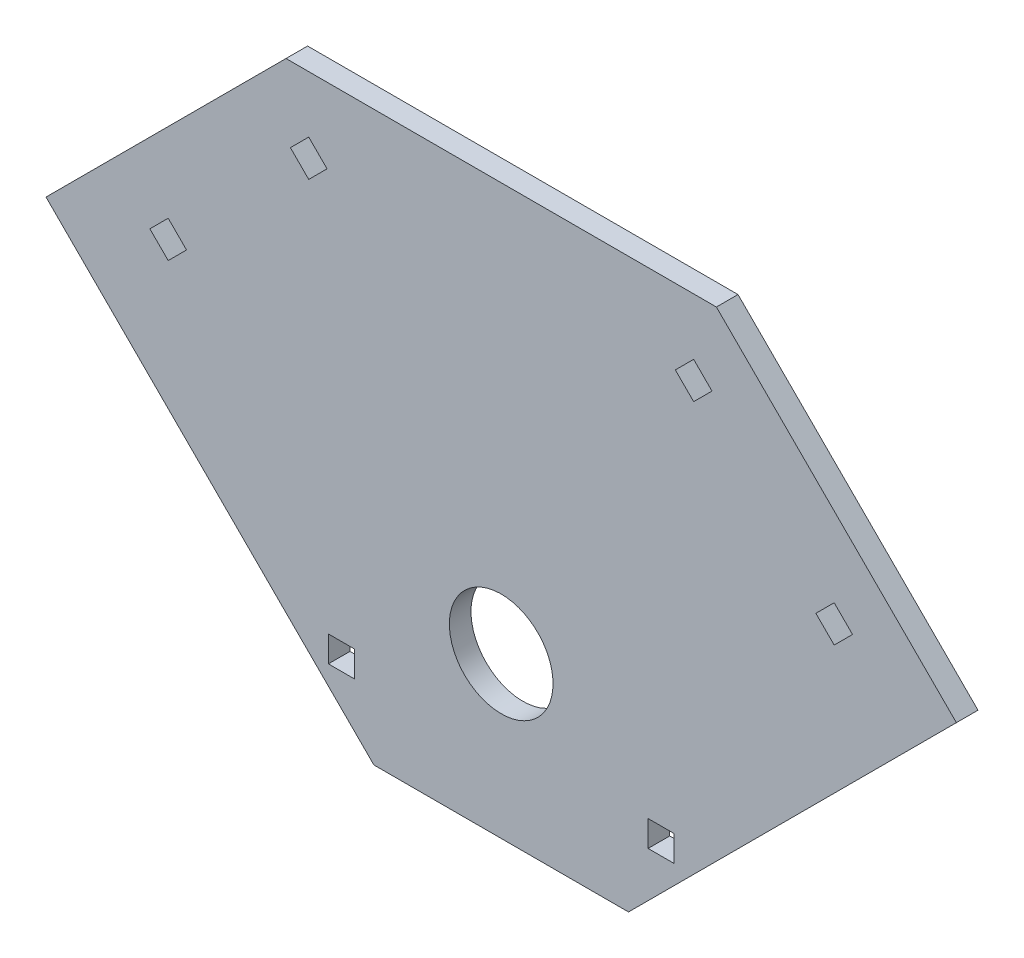
from build123d import *

# Parameters (mm, degrees)
SKETCH3_R           = 12
BOSS_EXTRUDE1_DEPTH = 5
BOSS_EXTRUDE2_DEPTH = 5
SKETCH6_W           = 6
SKETCH6_H           = 6
CUT_EXTRUDE1_DEPTH  = 5


with BuildPart() as part:
    # Sketch3 → Boss-Extrude1 (new body)
    with BuildSketch(Plane.XY):
        Polygon((-77.781745931, 49.497474683), (-49.497474683, 77.781745931), (-43.840620434, 83.43860018), (43.840620434, 83.43860018), (49.497474683, 77.781745931), (77.781745931, 49.497474683), (88.388347648, 38.890872965), (27.497474683, -22), (-27.497474683, -22), (-88.388347648, 38.890872965), align=None)
        Circle(SKETCH3_R, mode=Mode.SUBTRACT)
        Polygon((-81.317279836, 44.547727215), (-77.074639149, 48.790367902), (-72.831998462, 44.547727215), (-77.074639149, 40.305086528), align=None, mode=Mode.SUBTRACT)
        Polygon((-48.790367902, 77.074639149), (-44.547727215, 81.317279836), (-40.305086528, 77.074639149), (-44.547727215, 72.831998462), align=None, mode=Mode.SUBTRACT)
        Polygon((40.305086528, 77.074639149), (44.547727215, 72.831998462), (48.790367902, 77.074639149), (44.547727215, 81.317279836), align=None, mode=Mode.SUBTRACT)
        Polygon((72.831998462, 44.547727215), (77.074639149, 40.305086528), (81.317279836, 44.547727215), (77.074639149, 48.790367902), align=None, mode=Mode.SUBTRACT)
    extrude(amount=BOSS_EXTRUDE1_DEPTH)

    # Sketch5 → Boss-Extrude2 (add)
    with BuildSketch(Plane.XY.offset(5)):
        Polygon((-105.358910397, 38.890872965), (-49.811183182, 94.43860018), (49.811183182, 94.43860018), (105.358910397, 38.890872965), (29.468037432, -37), (-29.468037432, -37), align=None)
        Polygon((-43.840620434, 83.43860018), (-88.388347648, 38.890872965), (-27.497474683, -22), (27.497474683, -22), (88.388347648, 38.890872965), (43.840620434, 83.43860018), align=None, mode=Mode.SUBTRACT)
    extrude(amount=-BOSS_EXTRUDE2_DEPTH)

    # Sketch6 → Cut-Extrude1 (cut)
    with BuildSketch(Plane.XY.offset(5)):
        with Locations((-37, -19)):
            Rectangle(SKETCH6_W, SKETCH6_H)
        with Locations((37, -19)):
            Rectangle(SKETCH6_W, SKETCH6_H)
    extrude(amount=-CUT_EXTRUDE1_DEPTH, mode=Mode.SUBTRACT)


solid = part.part
